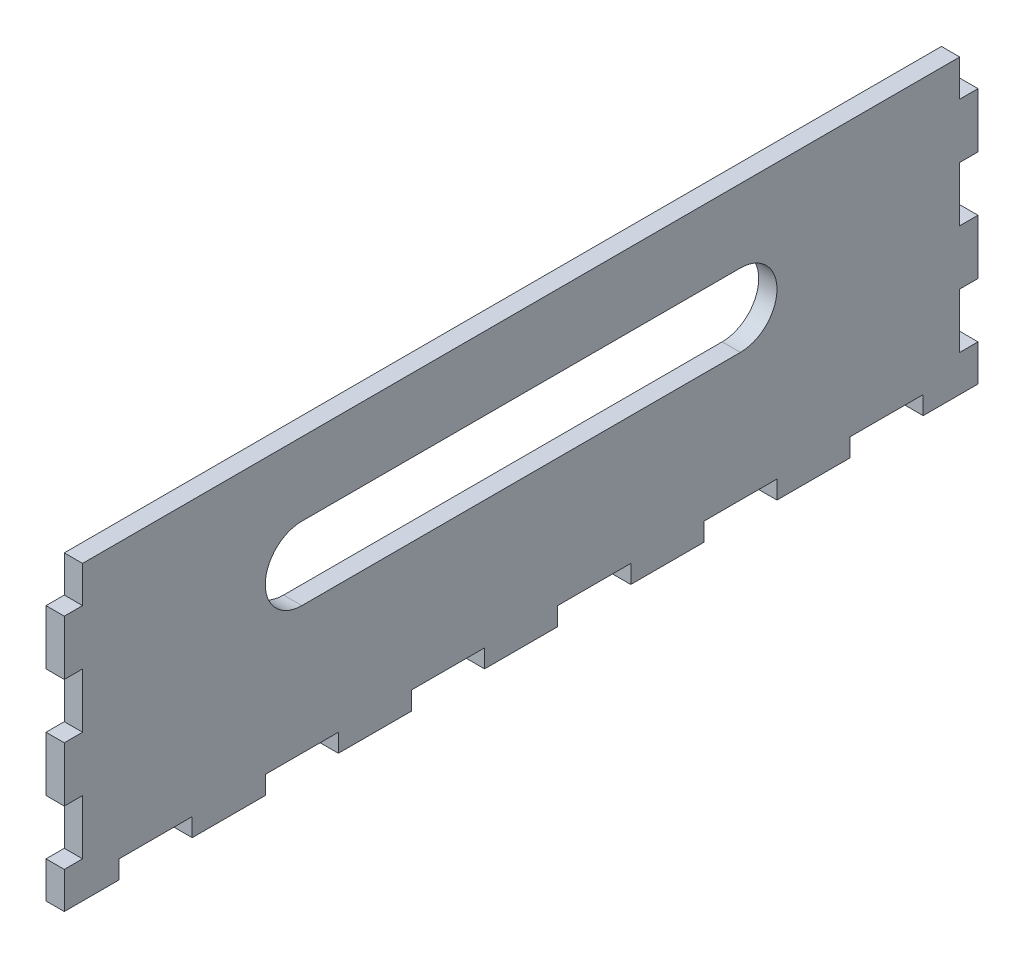
from build123d import *

# Parameters (mm, degrees)
BOSS_EXTRUDE1_DEPTH = 6.35


with BuildPart() as part:
    # Sketch2 → Boss-Extrude1 (new body)
    with BuildSketch(Plane(origin=(0, 0, 0), x_dir=(0, 0, -1), z_dir=(1, 0, 0))):
        Polygon((-152.4, 101.6), (152.4, 101.6), (152.4, 88.9), (158.75, 88.9), (158.75, 69.85), (152.4, 69.85), (152.4, 50.8), (158.75, 50.8), (158.75, 31.75), (152.4, 31.75), (152.4, 12.7), (158.75, 12.7), (158.75, 0), (139.7, 0), (139.7, 6.35), (114.3, 6.35), (114.3, 0), (88.9, 0), (88.9, 6.35), (63.5, 6.35), (63.5, 0), (38.1, 0), (38.1, 6.35), (12.7, 6.35), (12.7, 0), (-12.7, 0), (-12.7, 6.35), (-38.1, 6.35), (-38.1, 0), (-63.5, 0), (-63.5, 6.35), (-88.9, 6.35), (-88.9, 0), (-114.3, 0), (-114.3, 6.35), (-139.7, 6.35), (-139.7, 0), (-158.75, 0), (-158.75, 12.7), (-152.4, 12.7), (-152.4, 31.75), (-158.75, 31.75), (-158.75, 50.8), (-152.4, 50.8), (-152.4, 69.85), (-158.75, 69.85), (-158.75, 88.9), (-152.4, 88.9), align=None)
        with BuildLine():
            Line((-76.2, 50.8), (76.2, 50.8))
            ThreePointArc((76.2, 50.8), (88.9, 63.5), (76.2, 76.2))
            Line((76.2, 76.2), (-76.2, 76.2))
            ThreePointArc((-76.2, 76.2), (-88.9, 63.5), (-76.2, 50.8))
        make_face(mode=Mode.SUBTRACT)
    extrude(amount=BOSS_EXTRUDE1_DEPTH)


solid = part.part
